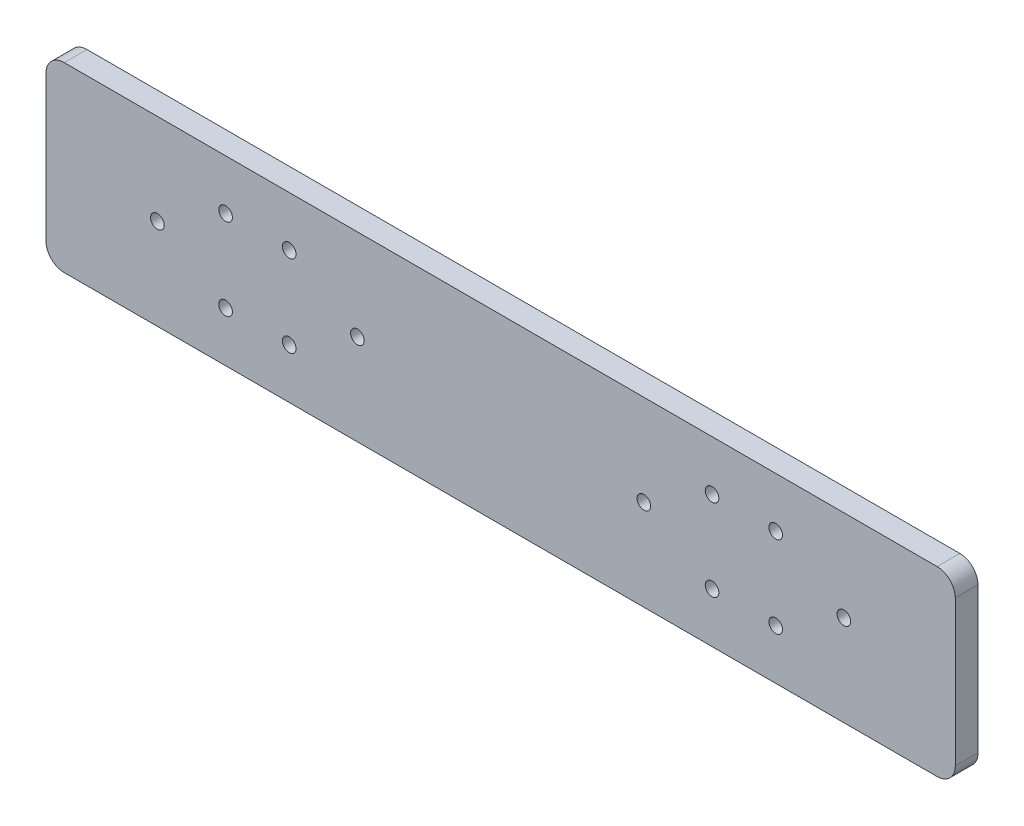
from build123d import *

# Parameters (mm, degrees)
ESQUISSE1_W             = 200
ESQUISSE1_H             = 40
BOSS_EXTRU_1_DEPTH      = 5
ESQUISSE5_W             = 35
ESQUISSE5_H             = 5
BOSS_EXTRU_3_DEPTH      = 35
ESQUISSE6_R             = 2.5
ENL_V_MAT_EXTRU_2_DEPTH = 35
ESQUISSE9_R             = 1.5
ENL_V_MAT_EXTRU_3_DEPTH = 35
CONG_2_R                = 4
ESQUISSE11_W            = 32.65685425
ESQUISSE11_H            = 33.828427125
BOSS_EXTRU_4_DEPTH      = 5
ESQUISSE14_R            = 6.5
ESQUISSE14_R_2          = 1.75
ESQUISSE14_R_3          = 1.749999999
ENL_V_MAT_EXTRU_4_DEPTH = 5


with BuildPart() as part:
    # Esquisse1 → Boss.-Extru.1 (new body)
    with BuildSketch(Plane.XY):
        with Locations((100, 20)):
            Rectangle(ESQUISSE1_W, ESQUISSE1_H)
    extrude(amount=-BOSS_EXTRU_1_DEPTH)

    # Esquisse5 → Boss.-Extru.3 (add)
    with BuildSketch(Plane(origin=(0, 0, -5), x_dir=(-1, 0, 0), z_dir=(0, 0, -1))):
        with Locations((-100, 2.5)):
            Rectangle(ESQUISSE5_W, ESQUISSE5_H)
    extrude(amount=BOSS_EXTRU_3_DEPTH)

    # Esquisse6 → Enlèv. mat.-Extru.2 (cut)
    with BuildSketch(Plane(origin=(0, 5, 0), x_dir=(1, 0, 0), z_dir=(0, 1, 0))):
        with Locations(Location((86.567832378, 36.000002876, 0), (0, 0, 270))):
            Circle(ESQUISSE6_R)
        with Locations(Location((113.567832366, 36.000575195, 0), (0, 0, 270))):
            Circle(ESQUISSE6_R)
        with Locations(Location((113.567832366, 9.000575195, 0), (0, 0, 270))):
            Circle(ESQUISSE6_R)
        with Locations(Location((86.5, 9.000575195, 0), (0, 0, 270))):
            Circle(ESQUISSE6_R)
    extrude(amount=-ENL_V_MAT_EXTRU_2_DEPTH, mode=Mode.SUBTRACT)

    # Esquisse9 → Enlèv. mat.-Extru.3 (cut)
    with BuildSketch(Plane.XY):
        with Locations((160.5, 11)):
            Circle(ESQUISSE9_R)
        with Locations((160.5, 29)):
            Circle(ESQUISSE9_R)
        with Locations((131.5, 20)):
            Circle(ESQUISSE9_R)
        with Locations(Location((68.5, 20, 0), (0, 0, 180))):
            Circle(ESQUISSE9_R)
        with Locations(Location((39.5, 29, 0), (0, 0, 180))):
            Circle(ESQUISSE9_R)
        with Locations(Location((39.5, 11, 0), (0, 0, 180))):
            Circle(ESQUISSE9_R)
        with Locations((24.5, 20)):
            Circle(ESQUISSE9_R)
        with Locations((53.5, 11)):
            Circle(ESQUISSE9_R)
        with Locations((53.5, 29)):
            Circle(ESQUISSE9_R)
        with Locations(Location((175.5, 20, 0), (0, 0, 180))):
            Circle(ESQUISSE9_R)
        with Locations(Location((146.5, 11, 0), (0, 0, 180))):
            Circle(ESQUISSE9_R)
        with Locations(Location((146.5, 29, 0), (0, 0, 180))):
            Circle(ESQUISSE9_R)
    extrude(amount=-ENL_V_MAT_EXTRU_3_DEPTH, mode=Mode.SUBTRACT)

    # Congé2
    cong_2_edges = [part.edges().sort_by_distance(p)[0] for p in [
        (117.5, 2.5, -40),
        (82.5, 2.5, -40),
        (0, 40, -2.5),
        (200, 40, -2.5),
        (200, 0, -2.5),
        (0, 0, -2.5),
    ]]
    fillet(cong_2_edges, radius=CONG_2_R)

    # Esquisse11 → Boss.-Extru.4 (add)
    with BuildSketch(Plane(origin=(0, 5, 0), x_dir=(1, 0, 0), z_dir=(0, 1, 0))):
        with Locations((100, 21.914213563)):
            Rectangle(ESQUISSE11_W, ESQUISSE11_H)
    extrude(amount=-BOSS_EXTRU_4_DEPTH)

    # Esquisse14 → Enlèv. mat.-Extru.4 (cut)
    with BuildSketch(Plane(origin=(0, 5, 0), x_dir=(1, 0, 0), z_dir=(0, 1, 0))):
        with Locations(Location((99.935028631, 22.564970946, 0), (0, 0, 270))):
            Circle(ESQUISSE14_R)
        with Locations(Location((99.935028631, 32.564970946, 0), (0, 0, 270))):
            Circle(ESQUISSE14_R_2)
        with Locations(Location((107.006096654, 29.636038546, 0), (0, 0, 270))):
            Circle(ESQUISSE14_R_2)
        with Locations(Location((109.935028631, 22.564970946, 0), (0, 0, 270))):
            Circle(ESQUISSE14_R_2)
        with Locations(Location((107.006096443, 15.493903134, 0), (0, 0, 270))):
            Circle(ESQUISSE14_R_2)
        with Locations(Location((99.935028631, 12.564970946, 0), (0, 0, 270))):
            Circle(ESQUISSE14_R_2)
        with Locations(Location((92.863960819, 15.493903134, 0), (0, 0, 270))):
            Circle(ESQUISSE14_R_2)
        with Locations(Location((89.935028631, 22.564970946, 0), (0, 0, 270))):
            Circle(ESQUISSE14_R_2)
        with Locations(Location((92.863961011, 29.636038989, 0), (0, 0, 270))):
            Circle(ESQUISSE14_R_3)
        with Locations(Location((113.370057685, 35.999999577, 0), (0, 0, 270))):
            Circle(ESQUISSE14_R_2)
        with Locations(Location((113.370057473, 9.129942103, 0), (0, 0, 270))):
            Circle(ESQUISSE14_R_2)
        with Locations(Location((86.5, 36, 0), (0, 0, 270))):
            Circle(ESQUISSE14_R_2)
        with Locations(Location((86.499999788, 9.129942103, 0), (0, 0, 270))):
            Circle(ESQUISSE14_R_2)
    extrude(amount=-ENL_V_MAT_EXTRU_4_DEPTH, mode=Mode.SUBTRACT)


solid = part.part
